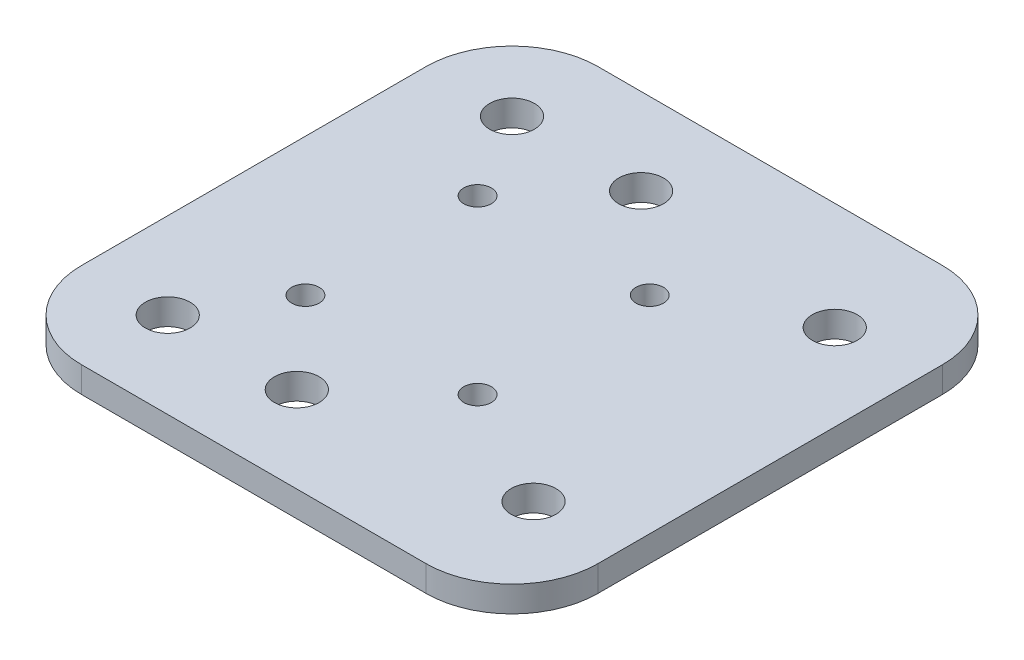
from build123d import *

# Parameters (mm, degrees)
EXTRUDE_1_DEPTH     = 3
SKETCH_2_R          = 1.6
SKETCH_2_R_2        = 2.6
CUT_EXTRUDE_1_DEPTH = 68.149087857
FILLET_1_R          = 10


with BuildPart() as part:
    # 草图1 → 凸台-拉伸1 (new body)
    with BuildSketch(Plane(origin=(0, 0, 0), x_dir=(1, 0, 0), z_dir=(0, 1, 0))):
        Polygon((0, -30), (0, 30), (21.715728753, 30), (60, 30), (60, -30), (21.715728753, -30), align=None)
    extrude(amount=EXTRUDE_1_DEPTH)

    # 草图2 → 切除-拉伸1 (cut, through all)
    with BuildSketch(Plane(origin=(0, 3, 0), x_dir=(1, 0, 0), z_dir=(0, 1, 0))):
        with Locations(Location((16, 10, 0), (0, 0, 270))):
            Circle(SKETCH_2_R)
        with Locations(Location((36, 10, 0), (0, 0, 270))):
            Circle(SKETCH_2_R)
        with Locations(Location((36, -10, 0), (0, 0, 90))):
            Circle(SKETCH_2_R)
        with Locations(Location((16, -10, 0), (0, 0, 90))):
            Circle(SKETCH_2_R)
        with Locations(Location((10, 20, 0), (0, 0, 270))):
            Circle(SKETCH_2_R_2)
        with Locations(Location((10, -20, 0), (0, 0, 270))):
            Circle(SKETCH_2_R_2)
        with Locations(Location((25, 20, 0), (0, 0, 270))):
            Circle(SKETCH_2_R_2)
        with Locations(Location((25, -20, 0), (0, 0, 270))):
            Circle(SKETCH_2_R_2)
        with Locations(Location((50, 17.5, 0), (0, 0, 270))):
            Circle(SKETCH_2_R_2)
        with Locations(Location((50, -17.5, 0), (0, 0, 270))):
            Circle(SKETCH_2_R_2)
    extrude(amount=-CUT_EXTRUDE_1_DEPTH, mode=Mode.SUBTRACT)

    # 圆角1
    fillet_1_edges = [part.edges().sort_by_distance(p)[0] for p in [
        (60, 1.5, -30),
        (60, 1.5, 30),
        (0, 1.5, 30),
        (0, 1.5, -30),
    ]]
    fillet(fillet_1_edges, radius=FILLET_1_R)


solid = part.part
